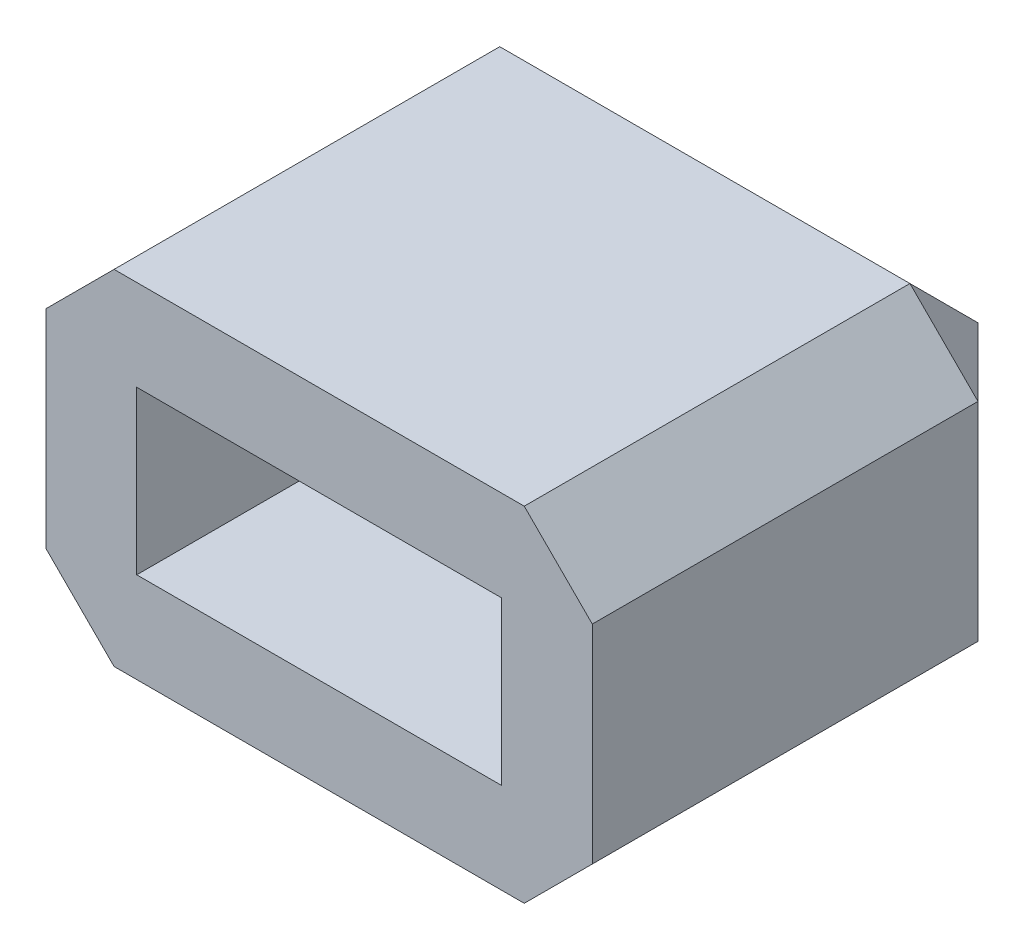
from build123d import *

# Parameters (mm, degrees)
SKETCH1_W           = 12.04
SKETCH1_H           = 7.58
SKETCH1_W_2         = 8.04
SKETCH1_H_2         = 3.58
BOSS_EXTRUDE1_DEPTH = 8
SKETCH1_2_W         = 12.04
SKETCH1_2_H         = 7.58
SKETCH1_2_W_2       = 8.04
SKETCH1_2_H_2       = 3.58
BOSS_EXTRUDE2_DEPTH = 2
CHAMFER1_SIZE       = 1.5


with BuildPart() as part:
    # Sketch1 → Boss-Extrude1 (new body)
    with BuildSketch(Plane.XY):
        Rectangle(SKETCH1_W, SKETCH1_H)
        Rectangle(SKETCH1_W_2, SKETCH1_H_2, mode=Mode.SUBTRACT)
    extrude(amount=BOSS_EXTRUDE1_DEPTH)

    # Sketch1<2> → Boss-Extrude2 (add)
    # profile 1 of 2: a face of its own
    with BuildSketch(Plane.XY):
        Rectangle(SKETCH1_2_W, SKETCH1_2_H)
        Rectangle(SKETCH1_2_W_2, SKETCH1_2_H_2, mode=Mode.SUBTRACT)
    # profile 2 of 2: a face of its own
    with BuildSketch(Plane.XY):
        Rectangle(SKETCH1_2_W_2, SKETCH1_2_H_2)
    extrude(amount=-BOSS_EXTRUDE2_DEPTH)

    # Chamfer1
    chamfer1_edges = [part.edges().sort_by_distance(p)[0] for p in [
        (0, -3.79, -2),
        (-6.02, 0, -2),
        (6.02, 0, -2),
        (0, 3.79, -2),
        (6.02, -3.79, 3),
        (-6.02, -3.79, 3),
        (-6.02, 3.79, 3),
        (6.02, 3.79, 3),
    ]]
    chamfer(chamfer1_edges, length=CHAMFER1_SIZE)


solid = part.part
